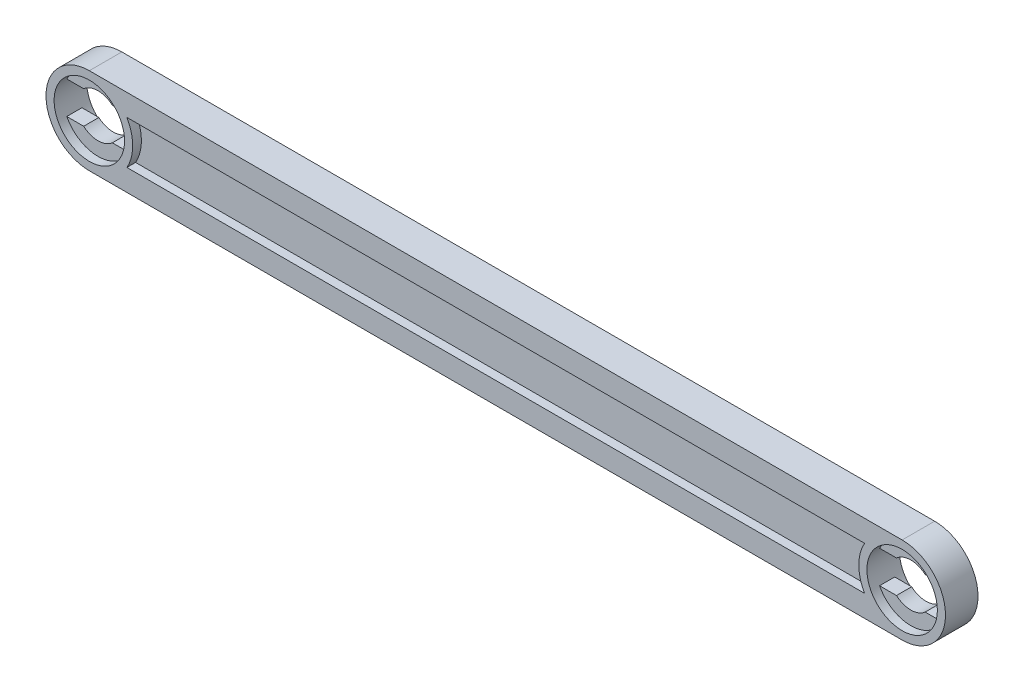
from build123d import *

# Parameters (mm, degrees)
EXTRUDE_1_DEPTH     = 3
CUT_EXTRUDE_1_REACH = 81.158
SKETCH_3_R          = 3.25
CUT_EXTRUDE_2_DEPTH = 0.8
CUT_EXTRUDE_START   = -2.2
SKETCH_3_2_R        = 3.25
CUT_EXTRUDE_3_DEPTH = 0.8
CUT_EXTRUDE_4_DEPTH = 0.8
SKETCH_5_W          = 67
SKETCH_5_H          = 4
CUT_EXTRUDE_5_DEPTH = 0.8


with BuildPart() as part:
    # 草图1 → 凸台-拉伸1 (new body)
    with BuildSketch(Plane.XY):
        with BuildLine():
            Line((0, 4), (75, 4))
            ThreePointArc((75, 4), (79, 0), (75, -4))
            Line((75, -4), (0, -4))
            ThreePointArc((0, -4), (-4, 0), (0, 4))
        make_face()
    extrude(amount=-EXTRUDE_1_DEPTH)

    # 草图2 → 切除-拉伸1 (cut, up to next)
    with BuildSketch(Plane.XY, mode=Mode.PRIVATE) as cut_extrude_1_sk1:
        with BuildLine():
            Line((1.322875656, -1.5), (2.883140649, -1.5))
            ThreePointArc((2.883140649, -1.5), (3.25, 0), (2.883140649, 1.5))
            Line((2.883140649, 1.5), (1.322875656, 1.5))
            ThreePointArc((1.322875656, 1.5), (0, 2), (-1.322875656, 1.5))
            Line((-1.322875656, 1.5), (-2.883140649, 1.5))
            ThreePointArc((-2.883140649, 1.5), (-3.25, 0), (-2.883140649, -1.5))
            Line((-2.883140649, -1.5), (-1.322875656, -1.5))
            ThreePointArc((-1.322875656, -1.5), (0, -2), (1.322875656, -1.5))
        make_face()
    cut_extrude_1_tool1 = extrude(cut_extrude_1_sk1.sketch, amount=-CUT_EXTRUDE_1_REACH, mode=Mode.PRIVATE) & part.part
    cut_extrude_1 = cut_extrude_1_tool1.solids().sort_by_distance((0, 0, 0))[0]
    add(cut_extrude_1, mode=Mode.SUBTRACT)

    # 草图3 → 切除-拉伸2 (cut)
    with BuildSketch(Plane.XY):
        Circle(SKETCH_3_R)
    cut_extrude_2 = extrude(amount=-CUT_EXTRUDE_2_DEPTH, mode=Mode.SUBTRACT)

    # 草图3<2> → 切除-拉伸3 (cut)
    with BuildSketch(Plane.XY.offset(CUT_EXTRUDE_START)):
        Circle(SKETCH_3_2_R)
    cut_extrude_3 = extrude(amount=-CUT_EXTRUDE_3_DEPTH, mode=Mode.SUBTRACT)

    # 镜向1: 切除-拉伸1, 切除-拉伸2, 切除-拉伸3 across plane
    add(cut_extrude_1.mirror(Plane(origin=(37.5, 0, 0), x_dir=(0, 0, 1), z_dir=(1, 0, 0))), mode=Mode.SUBTRACT)
    add(cut_extrude_2.mirror(Plane(origin=(37.5, 0, 0), x_dir=(0, 0, 1), z_dir=(1, 0, 0))), mode=Mode.SUBTRACT)
    add(cut_extrude_3.mirror(Plane(origin=(37.5, 0, 0), x_dir=(0, 0, 1), z_dir=(1, 0, 0))), mode=Mode.SUBTRACT)

    # 草图4 → 切除-拉伸4 (cut)
    with BuildSketch(Plane.XY):
        with BuildLine():
            Line((3.464101615, 2), (71.535898385, 2))
            ThreePointArc((71.535898385, 2), (71, 0), (71.535898385, -2))
            Line((71.535898385, -2), (3.464101615, -2))
            ThreePointArc((3.464101615, -2), (4, 0), (3.464101615, 2))
        make_face()
    extrude(amount=-CUT_EXTRUDE_4_DEPTH, mode=Mode.SUBTRACT)

    # 草图5 → 切除-拉伸5 (cut)
    with BuildSketch(Plane(origin=(0, 0, -3), x_dir=(-1, 0, 0), z_dir=(0, 0, -1))):
        with Locations((-37.5, 0)):
            Rectangle(SKETCH_5_W, SKETCH_5_H)
    extrude(amount=-CUT_EXTRUDE_5_DEPTH, mode=Mode.SUBTRACT)


solid = part.part
